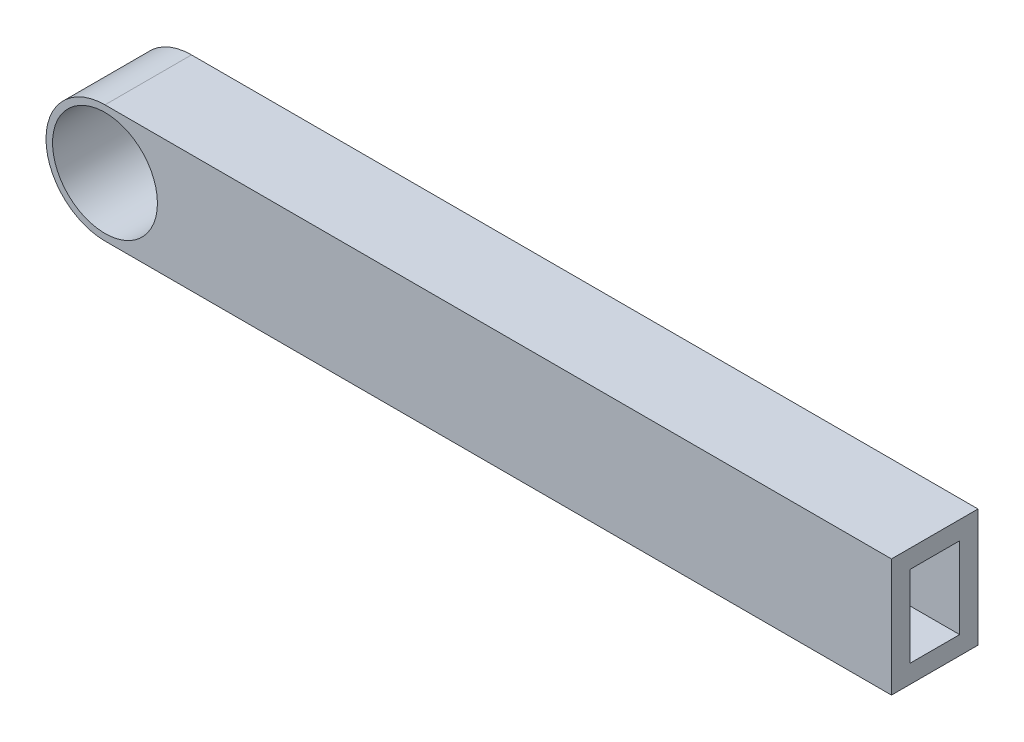
from build123d import *

# Parameters (mm, degrees)
SKETCH1_W           = 330
SKETCH1_H           = 45
BOSS_EXTRUDE1_DEPTH = 33
SKETCH2_R           = 20
CUT_EXTRUDE1_DEPTH  = 40
SKETCH3_W           = 19
SKETCH3_H           = 31
CUT_EXTRUDE2_DEPTH  = 260


with BuildPart() as part:
    # Sketch1 → Boss-Extrude1 (new body)
    with BuildSketch(Plane.XY):
        Rectangle(SKETCH1_W, SKETCH1_H)
    extrude(amount=BOSS_EXTRUDE1_DEPTH)

    # Sketch2 → Cut-Extrude1 (cut)
    with BuildSketch(Plane.XY.offset(33)):
        with Locations((-135, 0)):
            Circle(SKETCH2_R)
        with BuildLine():
            Line((-135, 22.5), (-173.521075779, 35.069593385))
            Line((-173.521075779, 35.069593385), (-171.569663812, -40.136425611))
            Line((-171.569663812, -40.136425611), (-135, -22.5))
            ThreePointArc((-135, -22.5), (-157.5, 0), (-135, 22.5))
        make_face()
    extrude(amount=-CUT_EXTRUDE1_DEPTH, mode=Mode.SUBTRACT)

    # Sketch3 → Cut-Extrude2 (cut)
    with BuildSketch(Plane(origin=(165, 0, 0), x_dir=(0, 0, -1), z_dir=(1, 0, 0))):
        with Locations((-16.5, 0)):
            Rectangle(SKETCH3_W, SKETCH3_H)
    extrude(amount=-CUT_EXTRUDE2_DEPTH, mode=Mode.SUBTRACT)


solid = part.part
